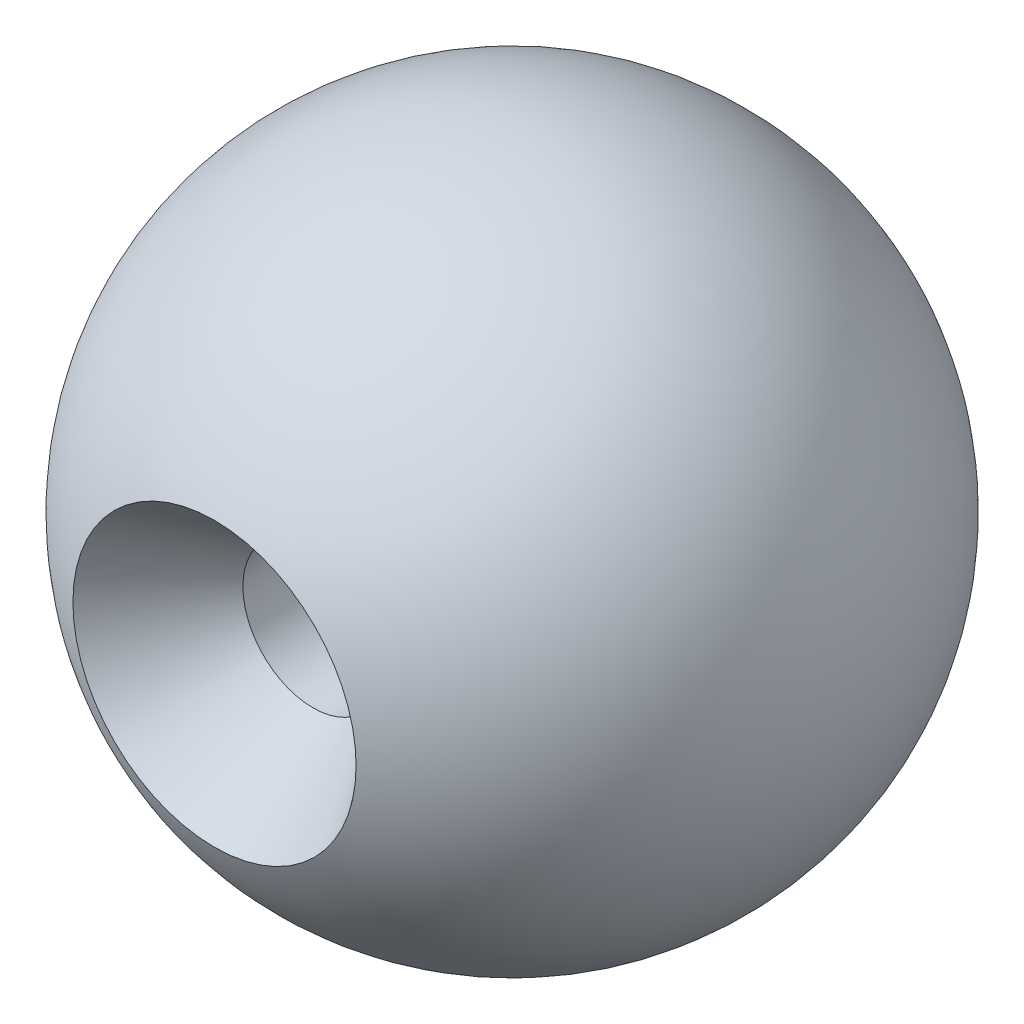
from build123d import *

# Parameters (mm, degrees)
SKETCH2_R          = 6
CONE_DEPTH         = 8
CONE_TAPER         = 36
SKETCH5_R          = 2.825
CUT_EXTRUDE3_DEPTH = 13
SKETCH4_W          = 5.5
SKETCH4_H          = 5.3
CUT_EXTRUDE2_DEPTH = 8
SKETCH6_R          = 2.55
CUT_EXTRUDE4_DEPTH = 10


with BuildPart() as part:
    # Sketch1 → Revolve1 (revolve)
    with BuildSketch(Plane(origin=(0, 0, 0), x_dir=(1, 0, 0), z_dir=(0, 1, 0))):
        with BuildLine():
            Line((0, -12), (0, 12))
            ThreePointArc((0, 12), (12, 0), (0, -12))
        make_face()
    revolve(axis=Axis((0, 0, 12), (0, 0, -1)))

    # Sketch2 → Cone (cut)
    with BuildSketch(Plane.XY.offset(12)):
        Circle(SKETCH2_R)
    extrude(amount=-CONE_DEPTH, taper=CONE_TAPER, mode=Mode.SUBTRACT)

    # Sketch5 → Cut-Extrude3 (cut)
    with BuildSketch(Plane(origin=(0, 0, -12), x_dir=(-1, 0, 0), z_dir=(0, 0, -1))):
        Circle(SKETCH5_R)
    extrude(amount=-CUT_EXTRUDE3_DEPTH, mode=Mode.SUBTRACT)

    # Sketch4 → Cut-Extrude2 (cut)
    with BuildSketch(Plane(origin=(0, -12, 0), x_dir=(-1, 0, 0), z_dir=(0, -1, 0))):
        Rectangle(SKETCH4_W, SKETCH4_H)
    extrude(amount=-CUT_EXTRUDE2_DEPTH, mode=Mode.SUBTRACT)

    # Sketch6 → Cut-Extrude4 (cut)
    with BuildSketch(Plane(origin=(0, 0, 1), x_dir=(-1, 0, 0), z_dir=(0, 0, -1))):
        Circle(SKETCH6_R)
    extrude(amount=-CUT_EXTRUDE4_DEPTH, mode=Mode.SUBTRACT)


solid = part.part
